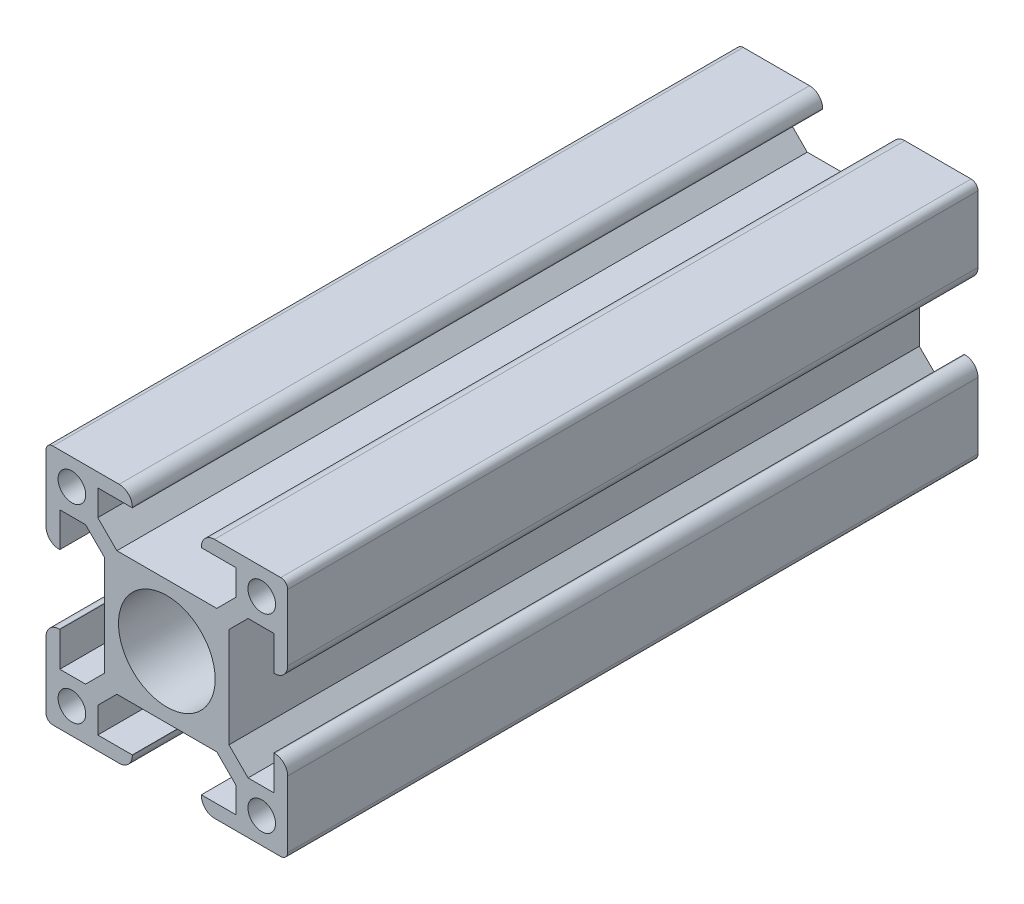
from build123d import *

# Parameters (mm, degrees)
SKETCH_1_R      = 7
SKETCH_1_R_2    = 2
EXTRUDE_1_DEPTH = 100


with BuildPart() as part:
    # 草图1 → 凸台-拉伸1 (new body)
    with BuildSketch(Plane.XY):
        with BuildLine():
            Line((-16.096789658, 15.945460798), (-16.096789658, 16.045460798))
            ThreePointArc((-16.096789658, 16.045460798), (-16.653286773, 17.388963682), (-17.996789658, 17.945460798))
            Line((-17.996789658, 17.945460798), (-27.596789658, 17.945460798))
            ThreePointArc((-27.596789658, 17.945460798), (-28.303896439, 17.652567579), (-28.596789658, 16.945460798))
            Line((-28.596789658, 16.945460798), (-28.596789658, 7.345460798))
            ThreePointArc((-28.596789658, 7.345460798), (-28.040292542, 6.001957914), (-26.696789658, 5.445460798))
            Line((-26.696789658, 5.445460798), (-26.596789658, 5.445460798))
            Line((-26.596789658, 5.445460798), (-26.596789658, 10.445460798))
            Line((-26.596789658, 10.445460798), (-22.864556611, 10.445460798))
            Line((-22.864556611, 10.445460798), (-20.096789658, 7.677693845))
            Line((-20.096789658, 7.677693845), (-20.096789658, -6.786772249))
            Line((-20.096789658, -6.786772249), (-22.864556611, -9.554539202))
            Line((-22.864556611, -9.554539202), (-26.596789658, -9.554539202))
            Line((-26.596789658, -9.554539202), (-26.596789658, -4.554539202))
            Line((-26.596789658, -4.554539202), (-26.696789658, -4.554539202))
            ThreePointArc((-26.696789658, -4.554539202), (-28.040292542, -5.111036318), (-28.596789658, -6.454539202))
            Line((-28.596789658, -6.454539202), (-28.596789658, -16.054539202))
            ThreePointArc((-28.596789658, -16.054539202), (-28.303896439, -16.761645983), (-27.596789658, -17.054539202))
            Line((-27.596789658, -17.054539202), (-17.996789658, -17.054539202))
            ThreePointArc((-17.996789658, -17.054539202), (-16.653286773, -16.498042086), (-16.096789658, -15.154539202))
            Line((-16.096789658, -15.154539202), (-16.096789658, -15.054539202))
            Line((-16.096789658, -15.054539202), (-21.096789658, -15.054539202))
            Line((-21.096789658, -15.054539202), (-21.096789658, -11.322306155))
            Line((-21.096789658, -11.322306155), (-18.329022705, -8.554539202))
            Line((-18.329022705, -8.554539202), (-3.864556611, -8.554539202))
            Line((-3.864556611, -8.554539202), (-1.096789658, -11.322306155))
            Line((-1.096789658, -11.322306155), (-1.096789658, -15.054539202))
            Line((-1.096789658, -15.054539202), (-6.096789658, -15.054539202))
            Line((-6.096789658, -15.054539202), (-6.096789658, -15.154539202))
            ThreePointArc((-6.096789658, -15.154539202), (-5.540292542, -16.498042086), (-4.196789658, -17.054539202))
            Line((-4.196789658, -17.054539202), (5.403210342, -17.054539202))
            ThreePointArc((5.403210342, -17.054539202), (6.110317124, -16.761645983), (6.403210342, -16.054539202))
            Line((6.403210342, -16.054539202), (6.403210342, -6.454539202))
            ThreePointArc((6.403210342, -6.454539202), (5.846713227, -5.111036318), (4.503210342, -4.554539202))
            Line((4.503210342, -4.554539202), (4.403210342, -4.554539202))
            Line((4.403210342, -4.554539202), (4.403210342, -9.554539202))
            Line((4.403210342, -9.554539202), (0.670977295, -9.554539202))
            Line((0.670977295, -9.554539202), (-2.096789658, -6.786772249))
            Line((-2.096789658, -6.786772249), (-2.096789658, 7.677693845))
            Line((-2.096789658, 7.677693845), (0.670977295, 10.445460798))
            Line((0.670977295, 10.445460798), (4.403210342, 10.445460798))
            Line((4.403210342, 10.445460798), (4.403210342, 5.445460798))
            Line((4.403210342, 5.445460798), (4.503210342, 5.445460798))
            ThreePointArc((4.503210342, 5.445460798), (5.846713227, 6.001957914), (6.403210342, 7.345460798))
            Line((6.403210342, 7.345460798), (6.403210342, 16.945460798))
            ThreePointArc((6.403210342, 16.945460798), (6.110317124, 17.652567579), (5.403210342, 17.945460798))
            Line((5.403210342, 17.945460798), (-4.196789658, 17.945460798))
            ThreePointArc((-4.196789658, 17.945460798), (-5.540292542, 17.388963682), (-6.096789658, 16.045460798))
            Line((-6.096789658, 16.045460798), (-6.096789658, 15.945460798))
            Line((-6.096789658, 15.945460798), (-1.096789658, 15.945460798))
            Line((-1.096789658, 15.945460798), (-1.096789658, 12.213227751))
            Line((-1.096789658, 12.213227751), (-3.864556611, 9.445460798))
            Line((-3.864556611, 9.445460798), (-18.329022705, 9.445460798))
            Line((-18.329022705, 9.445460798), (-21.096789658, 12.213227751))
            Line((-21.096789658, 12.213227751), (-21.096789658, 15.945460798))
            Line((-21.096789658, 15.945460798), (-16.096789658, 15.945460798))
        make_face()
        with Locations((-11.096789658, 0.445460798)):
            Circle(SKETCH_1_R, mode=Mode.SUBTRACT)
        with Locations((-24.846789658, 14.195460798)):
            Circle(SKETCH_1_R_2, mode=Mode.SUBTRACT)
        with Locations((2.653210342, 14.195460798)):
            Circle(SKETCH_1_R_2, mode=Mode.SUBTRACT)
        with Locations((-24.846789658, -13.304539202)):
            Circle(SKETCH_1_R_2, mode=Mode.SUBTRACT)
        with Locations((2.653210342, -13.304539202)):
            Circle(SKETCH_1_R_2, mode=Mode.SUBTRACT)
    extrude(amount=EXTRUDE_1_DEPTH)


solid = part.part
